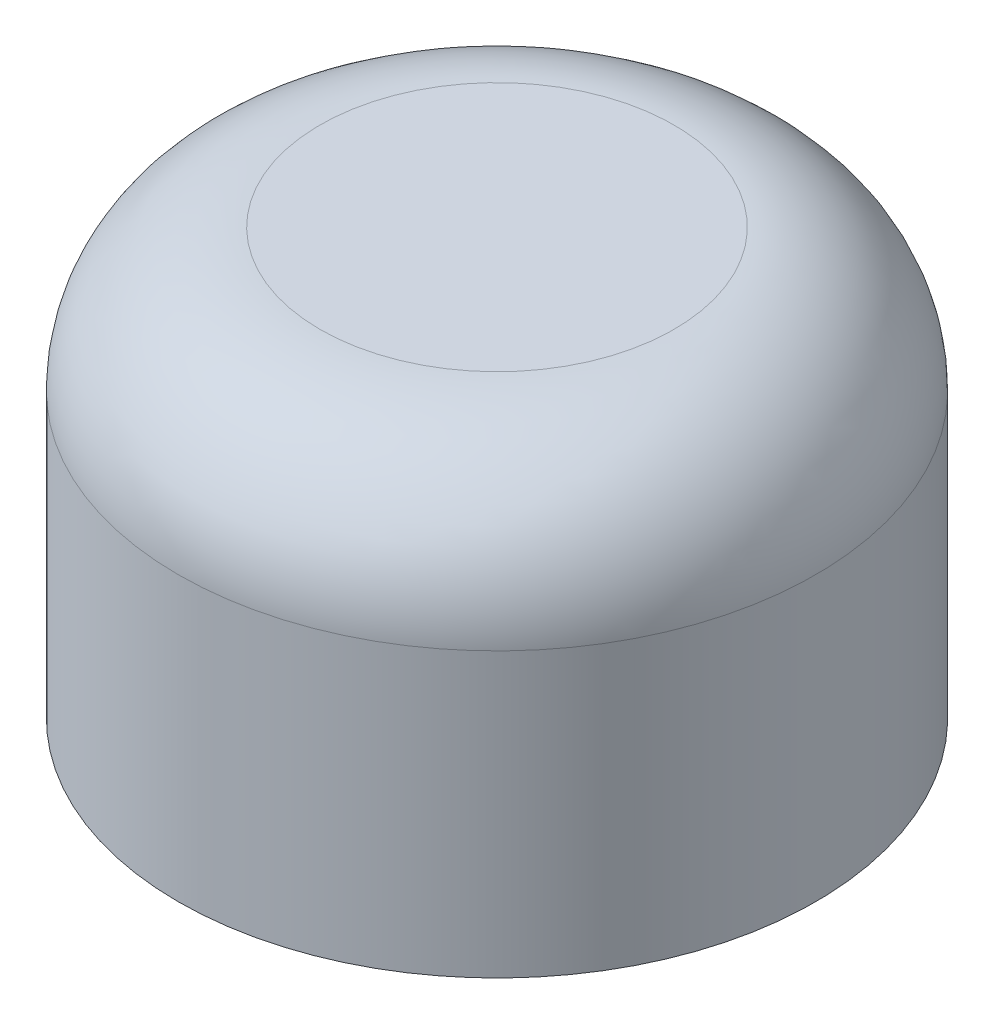
from build123d import *

# Parameters (mm, degrees)
SKETCH_1_R          = 11.25
EXTRUDE_1_DEPTH     = 15
FILLET_1_R          = 5
SKETCH_2_W          = 7.3
SKETCH_2_H          = 7.3
CUT_EXTRUDE_1_DEPTH = 8


with BuildPart() as part:
    # 草图1 → 凸台-拉伸1 (new body)
    with BuildSketch(Plane(origin=(0, 0, 0), x_dir=(1, 0, 0), z_dir=(0, 1, 0))):
        with Locations(Location((0, 0, 0), (0, 0, 270))):
            Circle(SKETCH_1_R)
    extrude(amount=EXTRUDE_1_DEPTH)

    # 圆角1
    fillet_1_edges = [part.edges().sort_by_distance(p)[0] for p in [
        (0, 15, -11.25),
    ]]
    fillet(fillet_1_edges, radius=FILLET_1_R)

    # 草图2 → 切除-拉伸1 (cut)
    with BuildSketch(Plane.XZ):
        Rectangle(SKETCH_2_W, SKETCH_2_H)
    extrude(amount=-CUT_EXTRUDE_1_DEPTH, mode=Mode.SUBTRACT)


solid = part.part
